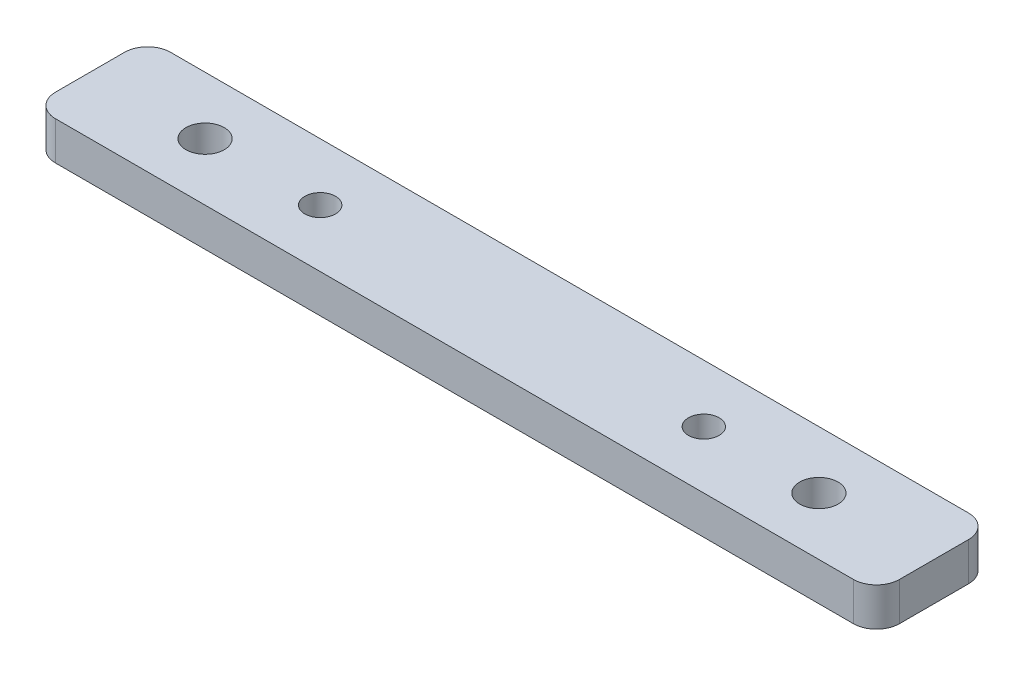
from build123d import *

# Parameters (mm, degrees)
SKETCH_1_W          = 110
SKETCH_1_H          = 15
EXTRUDE_1_DEPTH     = 5
FILLET_1_R          = 3
SKETCH_2_R          = 2.5
SKETCH_2_R_2        = 2
CUT_EXTRUDE_1_DEPTH = 5


with BuildPart() as part:
    # 草图1 → 凸台-拉伸1 (new body)
    with BuildSketch(Plane(origin=(0, 0, 0), x_dir=(1, 0, 0), z_dir=(0, 1, 0))):
        Rectangle(SKETCH_1_W, SKETCH_1_H)
    extrude(amount=EXTRUDE_1_DEPTH)

    # 圆角1
    fillet_1_edges = [part.edges().sort_by_distance(p)[0] for p in [
        (55, 2.5, 7.5),
        (-55, 2.5, 7.5),
        (-55, 2.5, -7.5),
        (55, 2.5, -7.5),
    ]]
    fillet(fillet_1_edges, radius=FILLET_1_R)

    # 草图2 → 切除-拉伸1 (cut)
    with BuildSketch(Plane(origin=(0, 5, 0), x_dir=(1, 0, 0), z_dir=(0, 1, 0))):
        with Locations(Location((40, 0, 0), (0, 0, 270))):
            Circle(SKETCH_2_R)
        with Locations(Location((25, 0, 0), (0, 0, 270))):
            Circle(SKETCH_2_R_2)
        with Locations(Location((-40, 0, 0), (0, 0, 90))):
            Circle(SKETCH_2_R)
        with Locations(Location((-25, 0, 0), (0, 0, 90))):
            Circle(SKETCH_2_R_2)
    extrude(amount=-CUT_EXTRUDE_1_DEPTH, mode=Mode.SUBTRACT)


solid = part.part
